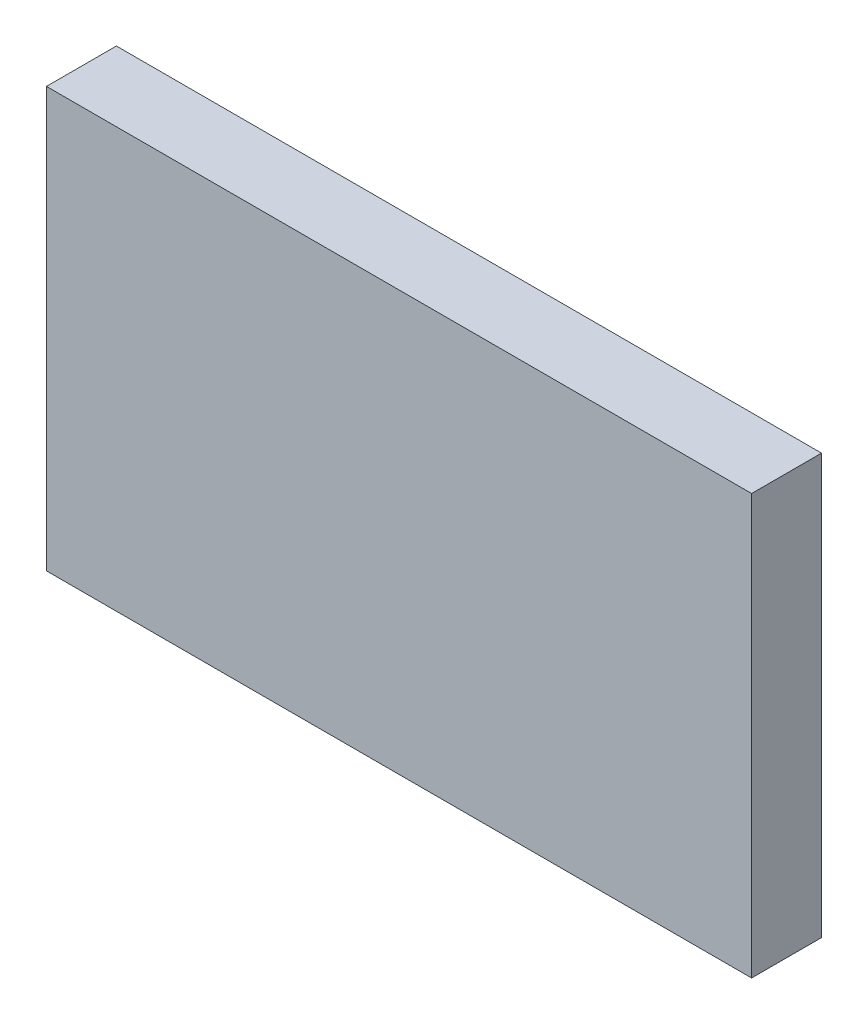
from build123d import *

# Parameters (mm, degrees)
SKETCH1_W           = 60.5
SKETCH1_H           = 36
BOSS_EXTRUDE1_DEPTH = 6


with BuildPart() as part:
    # Sketch1 → Boss-Extrude1 (new body)
    with BuildSketch(Plane.XY):
        Rectangle(SKETCH1_W, SKETCH1_H)
    extrude(amount=BOSS_EXTRUDE1_DEPTH)


solid = part.part
